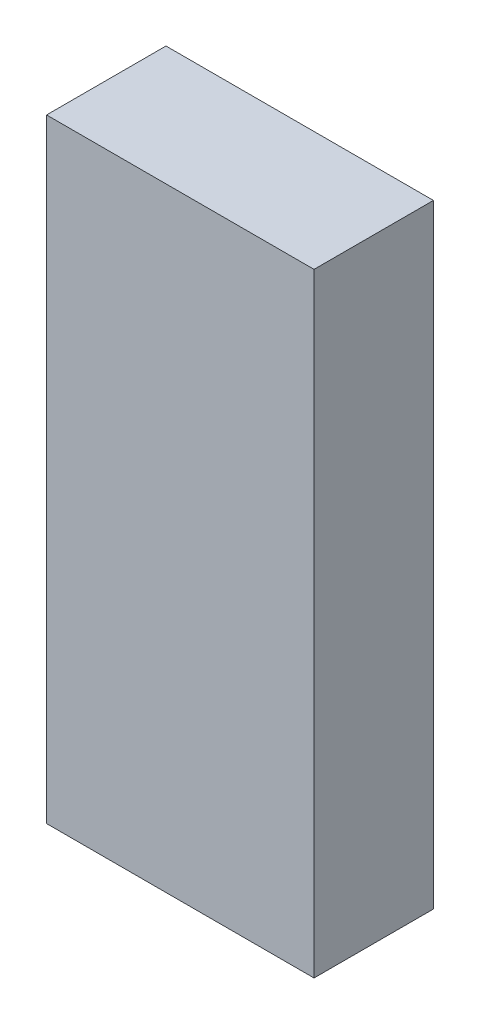
from build123d import *

# Parameters (mm, degrees)
SKETCH1_W           = 56
SKETCH1_H           = 25
BOSS_EXTRUDE1_DEPTH = 128.5


with BuildPart() as part:
    # Sketch1 → Boss-Extrude1 (new body)
    with BuildSketch(Plane(origin=(0, 0, 0), x_dir=(1, 0, 0), z_dir=(0, 1, 0))):
        Rectangle(SKETCH1_W, SKETCH1_H)
    extrude(amount=BOSS_EXTRUDE1_DEPTH)


solid = part.part
